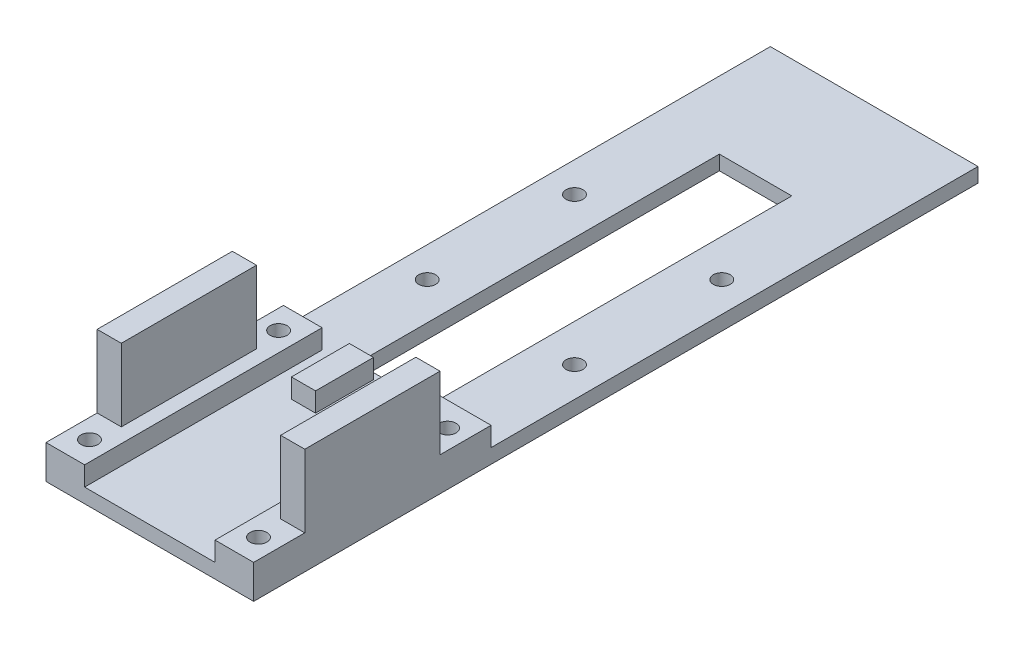
from build123d import *

# Parameters (mm, degrees)
SKETCH1_W           = 43
SKETCH1_H           = 150
BOSS_EXTRUDE1_DEPTH = 3
SKETCH2_R           = 1.75
CUT_EXTRUDE1_DEPTH  = 10
SKETCH3_W           = 15
SKETCH3_H           = 75
CUT_EXTRUDE2_DEPTH  = 10
SKETCH4_W           = 5
SKETCH4_H           = 12
SKETCH4_W_2         = 4.116849784
SKETCH4_H_2         = 1.5
SKETCH4_H_3         = 3.5
BOSS_EXTRUDE2_DEPTH = 4
SKETCH5_W           = 8
SKETCH5_H           = 49.17
BOSS_EXTRUDE3_DEPTH = 4
SKETCH7_W           = 0.35
SKETCH7_H           = 12
BOSS_EXTRUDE4_DEPTH = 4
SKETCH8_R           = 1.75
CUT_EXTRUDE3_DEPTH  = 79.334219853
SKETCH9_W           = 5
SKETCH9_H           = 28
BOSS_EXTRUDE5_DEPTH = 15
SKETCH10_R          = 3
CUT_EXTRUDE5_DEPTH  = 2


with BuildPart() as part:
    # Sketch1 → Boss-Extrude1 (new body)
    with BuildSketch(Plane(origin=(0, 0, 0), x_dir=(1, 0, 0), z_dir=(0, 1, 0))):
        Rectangle(SKETCH1_W, SKETCH1_H)
    extrude(amount=BOSS_EXTRUDE1_DEPTH)

    # Sketch2 → Cut-Extrude1 (cut)
    with BuildSketch(Plane(origin=(0, 3, 0), x_dir=(1, 0, 0), z_dir=(0, 1, 0))):
        with Locations(Location((15.25, 28.19, 0), (0, 0, 270))):
            Circle(SKETCH2_R)
        with Locations(Location((-15.25, 28.19, 0), (0, 0, 270))):
            Circle(SKETCH2_R)
        with Locations(Location((-15.25, -2.31, 0), (0, 0, 270))):
            Circle(SKETCH2_R)
        with Locations(Location((15.25, -2.31, 0), (0, 0, 270))):
            Circle(SKETCH2_R)
    extrude(amount=-CUT_EXTRUDE1_DEPTH, mode=Mode.SUBTRACT)

    # Sketch3 → Cut-Extrude2 (cut)
    with BuildSketch(Plane(origin=(0, 3, 0), x_dir=(1, 0, 0), z_dir=(0, 1, 0))):
        with Locations((0, 12.94)):
            Rectangle(SKETCH3_W, SKETCH3_H)
    extrude(amount=-CUT_EXTRUDE2_DEPTH, mode=Mode.SUBTRACT)

    # Sketch4 → Boss-Extrude2 (add)
    with BuildSketch(Plane(origin=(0, 3, 0), x_dir=(1, 0, 0), z_dir=(0, 1, 0))):
        with Locations((-5.35, -31.83)):
            Rectangle(SKETCH4_W, SKETCH4_H)
        with Locations((10.65, -31.83)):
            Rectangle(SKETCH4_W, SKETCH4_H)
        with Locations((4.708424892, -37.08)):
            Rectangle(SKETCH4_W_2, SKETCH4_H_2)
        with Locations((4.708424892, -39.58)):
            Rectangle(SKETCH4_W_2, SKETCH4_H_3)
    extrude(amount=BOSS_EXTRUDE2_DEPTH)

    # Sketch5 → Boss-Extrude3 (add)
    with BuildSketch(Plane(origin=(0, 3, 0), x_dir=(1, 0, 0), z_dir=(0, 1, 0))):
        with Locations((-17.5, -50.415)):
            Rectangle(SKETCH5_W, SKETCH5_H)
        with Locations((17.5, -50.415)):
            Rectangle(SKETCH5_W, SKETCH5_H)
    extrude(amount=BOSS_EXTRUDE3_DEPTH)

    # Sketch7 → Boss-Extrude4 (add)
    with BuildSketch(Plane(origin=(0, 3, 0), x_dir=(1, 0, 0), z_dir=(0, 1, 0))):
        with Locations((13.325, -31.83)):
            Rectangle(SKETCH7_W, SKETCH7_H)
    extrude(amount=BOSS_EXTRUDE4_DEPTH)

    # Sketch8 → Cut-Extrude3 (cut, through all)
    with BuildSketch(Plane(origin=(0, 7, 0), x_dir=(1, 0, 0), z_dir=(0, 1, 0))):
        with Locations(Location((17.5, -70, 0), (0, 0, 270))):
            Circle(SKETCH8_R)
        with Locations(Location((17.5, -30.83, 0), (0, 0, 90))):
            Circle(SKETCH8_R)
        with Locations(Location((-17.5, -70, 0), (0, 0, 90))):
            Circle(SKETCH8_R)
        with Locations(Location((-17.5, -30.83, 0), (0, 0, 270))):
            Circle(SKETCH8_R)
    extrude(amount=-CUT_EXTRUDE3_DEPTH, mode=Mode.SUBTRACT)

    # Sketch9 → Boss-Extrude5 (add)
    with BuildSketch(Plane(origin=(0, 7, 0), x_dir=(1, 0, 0), z_dir=(0, 1, 0))):
        with Locations((19, -50.41)):
            Rectangle(SKETCH9_W, SKETCH9_H)
        with Locations((-19, -50.41)):
            Rectangle(SKETCH9_W, SKETCH9_H)
    extrude(amount=BOSS_EXTRUDE5_DEPTH)

    # Sketch10 → Cut-Extrude5 (cut)
    with BuildSketch(Plane.XZ):
        with Locations(Location((-17.5, 70, 0), (0, 0, 270))):
            Circle(SKETCH10_R)
        with Locations(Location((-17.5, 30.83, 0), (0, 0, 270))):
            Circle(SKETCH10_R)
        with Locations(Location((17.5, 30.83, 0), (0, 0, 270))):
            Circle(SKETCH10_R)
        with Locations(Location((17.5, 70, 0), (0, 0, 270))):
            Circle(SKETCH10_R)
    extrude(amount=-CUT_EXTRUDE5_DEPTH, mode=Mode.SUBTRACT)


solid = part.part
